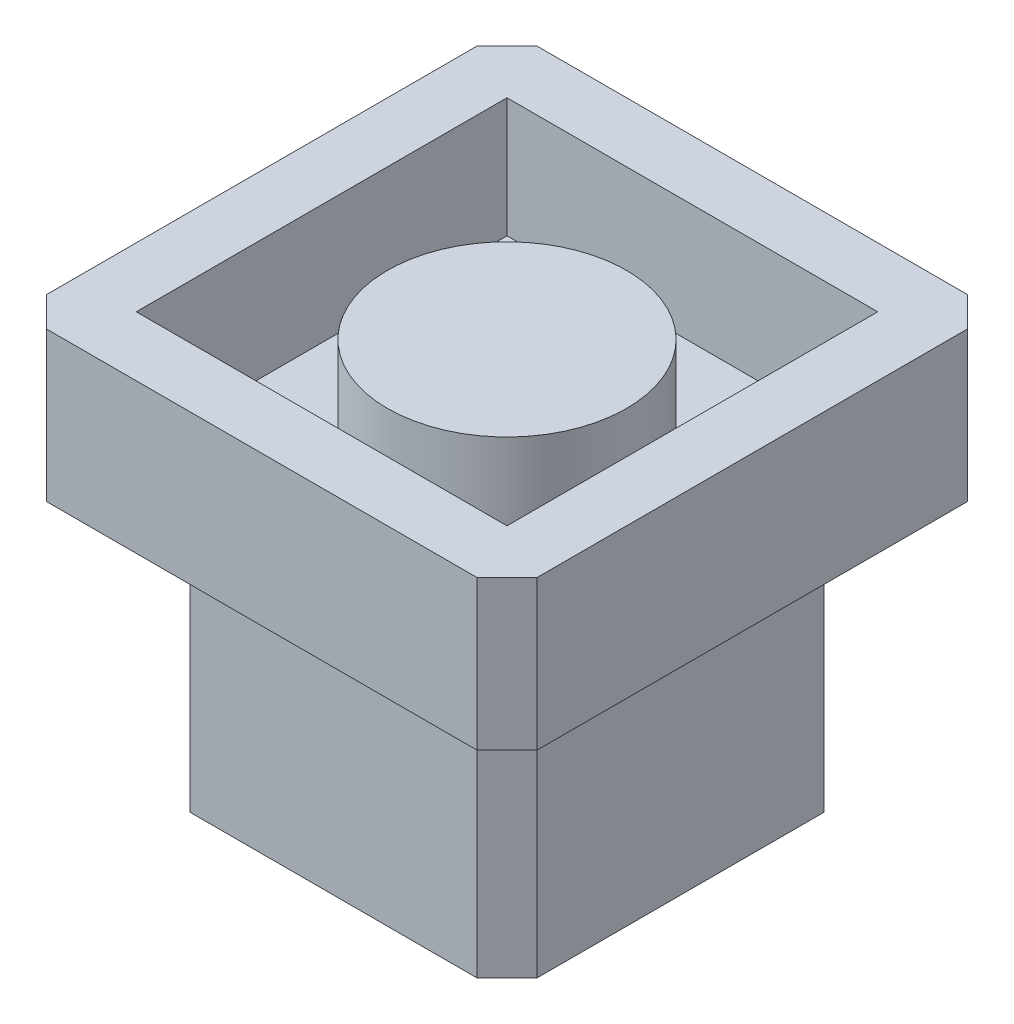
from build123d import *

# Parameters (mm, degrees)
SKETCH1_R           = 2
BOSS_EXTRUDE1_DEPTH = 1.6
SKETCH1_3_W         = 8.2
SKETCH1_3_H         = 8.2
SKETCH1_3_W_2       = 6.2
SKETCH1_3_H_2       = 6.2
BOSS_EXTRUDE2_DEPTH = 2
SKETCH1_4_W         = 8.2
SKETCH1_4_H         = 8.2
BOSS_EXTRUDE3_DEPTH = 0.5
SKETCH3_W           = 5.8
SKETCH3_H           = 5.8
BOSS_EXTRUDE4_DEPTH = 4.5
CHAMFER1_SIZE       = 0.5
CUT_EXTRUDE1_DEPTH  = 0.2


with BuildPart() as part:
    # Sketch1 → Boss-Extrude1 (new body)
    with BuildSketch(Plane(origin=(0, 0, 0), x_dir=(1, 0, 0), z_dir=(0, 1, 0))):
        Circle(SKETCH1_R)
    extrude(amount=BOSS_EXTRUDE1_DEPTH)



with BuildPart() as body_2:
    # Sketch1<3> → Boss-Extrude2 (new body)
    with BuildSketch(Plane(origin=(0, 0, 0), x_dir=(1, 0, 0), z_dir=(0, 1, 0))):
        Rectangle(SKETCH1_3_W, SKETCH1_3_H)
        Rectangle(SKETCH1_3_W_2, SKETCH1_3_H_2, mode=Mode.SUBTRACT)
    extrude(amount=BOSS_EXTRUDE2_DEPTH)


with BuildPart() as part_1:
    add(part.part)

    add(body_2.part)  # Boss-Extrude3 merges body 2
    # Sketch1<4> → Boss-Extrude3 (add)
    with BuildSketch(Plane(origin=(0, 0, 0), x_dir=(1, 0, 0), z_dir=(0, 1, 0))):
        Rectangle(SKETCH1_4_W, SKETCH1_4_H)
    extrude(amount=-BOSS_EXTRUDE3_DEPTH)

    # Sketch3 → Boss-Extrude4 (add)
    with BuildSketch(Plane.XZ.offset(0.5)):
        Rectangle(SKETCH3_W, SKETCH3_H)
    extrude(amount=BOSS_EXTRUDE4_DEPTH)

    # Chamfer1
    chamfer1_edges = [part_1.edges().sort_by_distance(p)[0] for p in [
        (-4.1, 0.75, -4.1),
        (4.1, 0.75, -4.1),
        (-4.1, 0.75, 4.1),
        (4.1, 0.75, 4.1),
        (-2.9, -2.75, 2.9),
        (2.9, -2.75, 2.9),
        (-2.9, -2.75, -2.9),
        (2.9, -2.75, -2.9),
    ]]
    chamfer(chamfer1_edges, length=CHAMFER1_SIZE)

    # Sketch4 → Cut-Extrude1 (cut)
    with BuildSketch(Plane.XZ.offset(5)):
        Polygon((0.178918545, 2.162051717), (1.79430316, -1.337948283), (1.452856846, -1.337948283), (0.935428962, -0.216153411), (-0.65120966, -0.216153411), (-1.183361102, -1.337948283), (-1.52620966, -1.337948283), (0.13404675, 2.162051717), align=None)
        Polygon((0.152977039, 1.479860211), (-0.480837064, 0.142820948), (0.769964218, 0.142820948), align=None, mode=Mode.SUBTRACT)
    extrude(amount=-CUT_EXTRUDE1_DEPTH, mode=Mode.SUBTRACT)


solid = part_1.part
